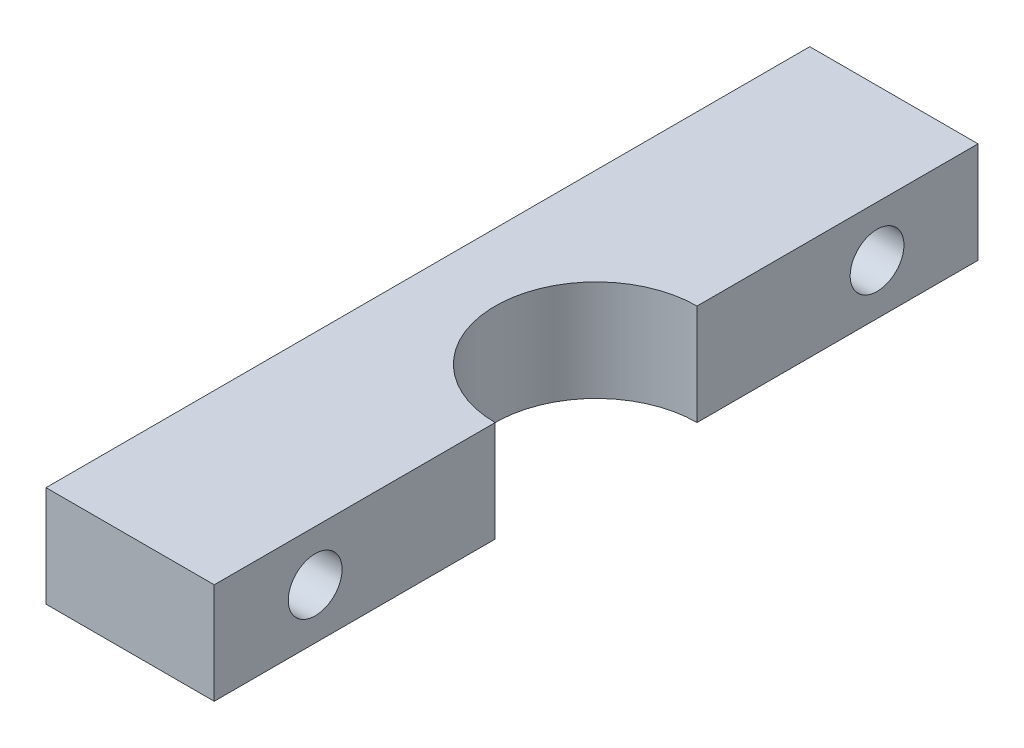
from build123d import *

# Parameters (mm, degrees)
BOSS_EXTRUDE1_DEPTH        = 6
F_3_2_3_2_DIAMETER_HOLE1_D = 3.2


with BuildPart() as part:
    # Sketch1 → Boss-Extrude1 (new body)
    with BuildSketch(Plane(origin=(0, 0, 0), x_dir=(1, 0, 0), z_dir=(0, 1, 0))):
        with BuildLine():
            Line((10, 28.7), (10, 45.4))
            Line((10, 45.4), (0, 45.4))
            Line((0, 45.4), (0, 0))
            Line((0, 0), (10, 0))
            Line((10, 0), (10, 16.7))
            ThreePointArc((10, 16.7), (4, 22.7), (10, 28.7))
        make_face()
    extrude(amount=BOSS_EXTRUDE1_DEPTH)

    # Ø3.2 (3.2) Diameter Hole1 (through all)
    with Locations(Plane.ZY):
        with Locations((-6, 3), (-39.4, 3)):
            Hole(F_3_2_3_2_DIAMETER_HOLE1_D / 2)


solid = part.part
